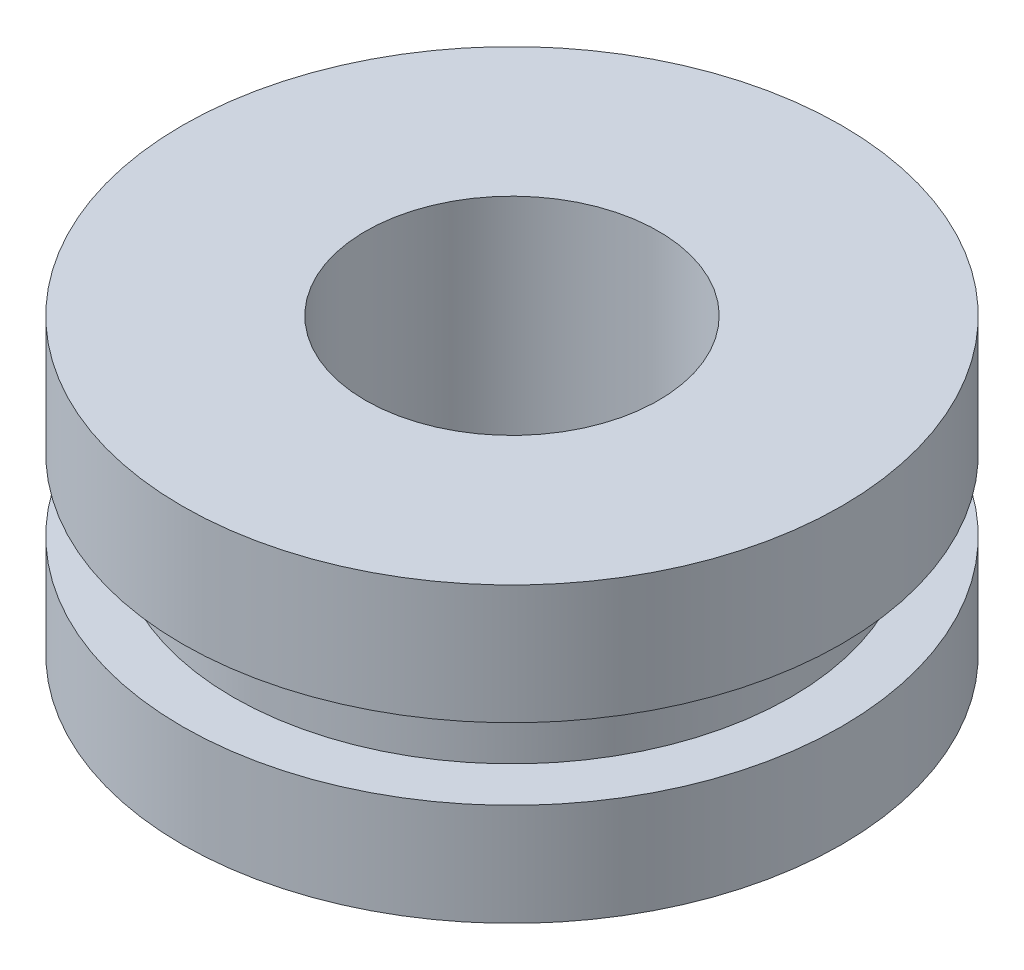
from build123d import *

# Parameters (mm, degrees)
SKETCH_1_R      = 4.5
SKETCH_1_R_2    = 2
EXTRUDE_1_DEPTH = 4
SKETCH_2_W      = 0.693229727
SKETCH_2_H      = 0.975939513


with BuildPart() as part:
    # 草图1 → 凸台-拉伸1 (new body)
    with BuildSketch(Plane(origin=(0, 0, 0), x_dir=(1, 0, 0), z_dir=(0, 1, 0))):
        with Locations(Location((0, 0, 0), (0, 0, 270))):
            Circle(SKETCH_1_R)
        with Locations(Location((0, 0, 0), (0, 0, 270))):
            Circle(SKETCH_1_R_2, mode=Mode.SUBTRACT)
    extrude(amount=EXTRUDE_1_DEPTH)

    # 草图2 → 切除-旋转1 (revolve, cut)
    with BuildSketch(Plane.XY, mode=Mode.PRIVATE) as cut_revolve_1_sk:
        with Locations((-4.153385136, 1.883358194)):
            Rectangle(SKETCH_2_W, SKETCH_2_H)
    revolve(cut_revolve_1_sk.sketch.rotate(Axis((0, 4, 0), (0, -1, 0)), 270), axis=Axis((0, 4, 0), (0, -1, 0)), mode=Mode.SUBTRACT)


solid = part.part
